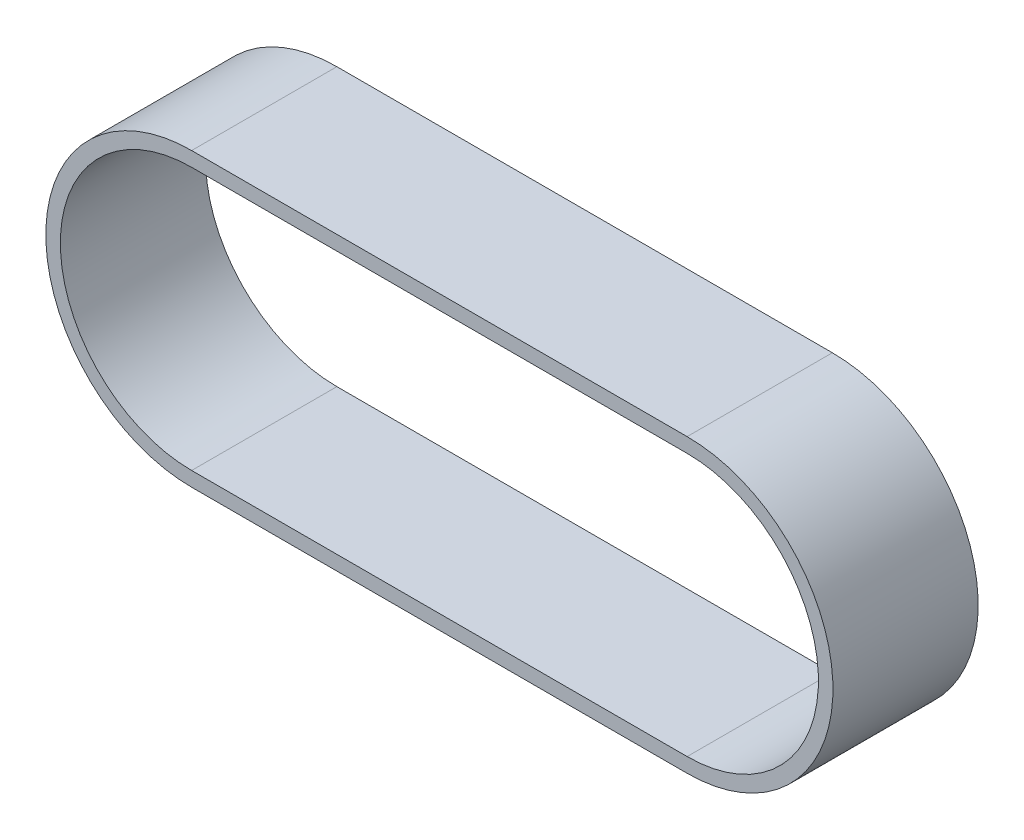
from build123d import *

# Parameters (mm, degrees)
AUFSATZ_LINEAR_AUSTRAGEN1_DEPTH = 2.5


with BuildPart() as part:
    # Skizze1 → Aufsatz-Linear austragen1 (new, symmetric)
    with BuildSketch(Plane.XY):
        with BuildLine():
            Line((0, 5.02), (17.06, 5.02))
            ThreePointArc((17.06, 5.02), (22.08, 0), (17.06, -5.02))
            Line((17.06, -5.02), (0, -5.02))
            ThreePointArc((0, -5.02), (-5.02, 0), (0, 5.02))
        make_face()
        with BuildLine():
            Line((0, 4.52), (17.06, 4.52))
            ThreePointArc((17.06, 4.52), (21.58, 0), (17.06, -4.52))
            Line((17.06, -4.52), (0, -4.52))
            ThreePointArc((0, -4.52), (-4.52, 0), (0, 4.52))
        make_face(mode=Mode.SUBTRACT)
    extrude(amount=AUFSATZ_LINEAR_AUSTRAGEN1_DEPTH, both=True)


solid = part.part
